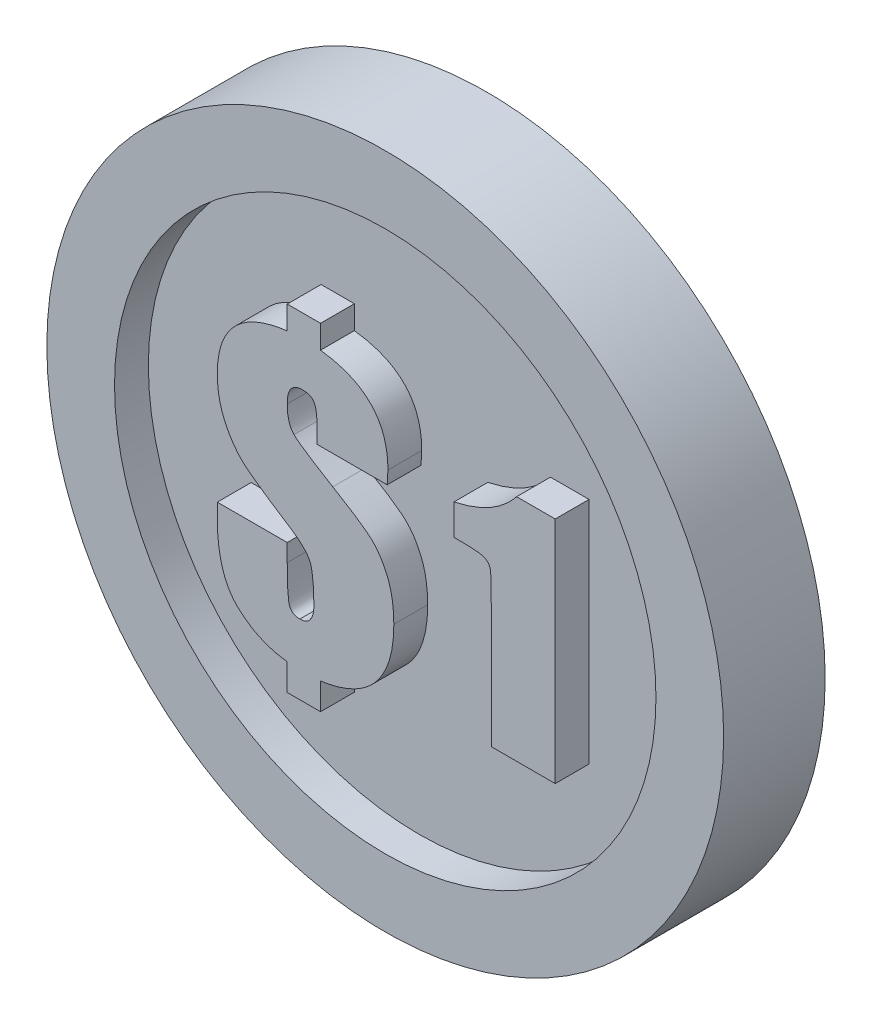
from build123d import *

# Parameters (mm, degrees)
SKETCH_1_R          = 10
EXTRUDE_1_DEPTH     = 3
SKETCH_2_R          = 8
CUT_EXTRUDE_1_DEPTH = 1
EXTRUDE_3_DEPTH     = 1


with BuildPart() as part:
    # 草图1 → 凸台-拉伸1 (new body)
    with BuildSketch(Plane.XY):
        Circle(SKETCH_1_R)
    extrude(amount=EXTRUDE_1_DEPTH)

    # 草图2 → 切除-拉伸1 (cut)
    with BuildSketch(Plane.XY.offset(3)):
        Circle(SKETCH_2_R)
    extrude(amount=-CUT_EXTRUDE_1_DEPTH, mode=Mode.SUBTRACT)

    # 草图4 → 凸台-拉伸3 (add)
    with BuildSketch(Plane.XY.offset(2)):
        with BuildLine():
            Line((0.056762987, 1.474211792), (-2.010233509, 1.474211792))
            Line((-2.010233509, 1.474211792), (-2.010233509, 1.80333177))
            add(Edge.make_bspline(
                [(-2.010233509, 1.80333177), (-2.010714949, 1.845366066), (-2.011636853, 1.925857174), (-2.013443384, 2.040830842), (-2.021934942, 2.144355468), (-2.031073109, 2.236120108), (-2.040588927, 2.31710552), (-2.056465146, 2.385691054), (-2.072751931, 2.443681195), (-2.098421022, 2.504945758), (-2.146218174, 2.567628601), (-2.227072107, 2.622444592), (-2.333658747, 2.649566324), (-2.411001767, 2.653311278), (-2.45316133, 2.655352647)],
                knots=[0, 0, 0, 0, 1.359919446, 2.604097865, 3.718258517, 4.718210111, 5.588312068, 6.352757529, 6.992875727, 7.535071206, 8.493600252, 9.496298216, 10.635235939, 12, 12, 12, 12], degree=3))
            add(Edge.make_bspline(
                [(-2.45316133, 2.655352647), (-2.48769324, 2.653727226), (-2.553890817, 2.650611298), (-2.646642148, 2.622991559), (-2.725077805, 2.574799662), (-2.789460033, 2.508992999), (-2.837678653, 2.423435949), (-2.872664288, 2.321405275), (-2.891615661, 2.200286181), (-2.894528446, 2.114059415), (-2.89608915, 2.067858107)],
                knots=[0, 0, 0, 0, 0.988105774, 1.894196063, 2.738146432, 3.600308196, 4.502221556, 5.528881054, 6.675945596, 8, 8, 8, 8], degree=3))
            add(Edge.make_bspline(
                [(-2.89608915, 2.067858107), (-2.894449613, 1.992202619), (-2.891412238, 1.85204466), (-2.851820774, 1.660792354), (-2.795166347, 1.499557252), (-2.727751468, 1.419469509), (-2.696156454, 1.381935163)],
                knots=[0, 0, 0, 0, 1.238590262, 2.294589406, 3.200733242, 4, 4, 4, 4], degree=3))
            add(Edge.make_bspline(
                [(-2.696156454, 1.381935163), (-2.676461776, 1.363134012), (-2.630861227, 1.319602312), (-2.545176258, 1.255053383), (-2.437113188, 1.178219265), (-2.306005051, 1.088728044), (-2.150665321, 0.987994219), (-1.972415244, 0.873613916), (-1.769467583, 0.749717147), (-1.625830171, 0.664089009), (-1.550388307, 0.619115027)],
                knots=[0, 0, 0, 0, 0.473750368, 1.096909409, 1.864751644, 2.783261057, 3.860202471, 5.088360878, 6.470736284, 8, 8, 8, 8], degree=3))
            add(Edge.make_bspline(
                [(-1.550388307, 0.619115027), (-1.485198527, 0.580292401), (-1.360104373, 0.505794778), (-1.181709189, 0.396565598), (-1.019465077, 0.294906955), (-0.873253022, 0.199660286), (-0.743042002, 0.110905609), (-0.629062244, 0.029561017), (-0.531324757, -0.044462306), (-0.421492641, -0.134926314), (-0.298119069, -0.256239512), (-0.16776821, -0.425307224), (-0.049470339, -0.620618928), (0.056905891, -0.841480009), (0.147481943, -1.089394), (0.208560212, -1.367548532), (0.2478522, -1.673343211), (0.251643957, -1.887086396), (0.253619796, -1.998465357)],
                knots=[0, 0, 0, 0, 1.071987144, 2.057060554, 2.955337459, 3.77699406, 4.522318602, 5.181589955, 5.755251306, 6.254177214, 7.191438167, 8.192596657, 9.262134101, 10.412151394, 11.651634359, 12.981704702, 14.427203216, 16, 16, 16, 16], degree=3))
            add(Edge.make_bspline(
                [(0.253619796, -1.998465357), (0.252520604, -2.088771103), (0.250373462, -2.265172779), (0.222764294, -2.521443005), (0.18288396, -2.763633873), (0.12157342, -2.989934303), (0.048224142, -3.203329396), (-0.04764749, -3.399426406), (-0.155935901, -3.582886354), (-0.284918565, -3.748769407), (-0.428419819, -3.901762054), (-0.591566185, -4.036202813), (-0.768685194, -4.159846558), (-0.965671944, -4.262796907), (-1.17743885, -4.354992249), (-1.406900356, -4.429013379), (-1.652957644, -4.490181019), (-1.823878665, -4.516421874), (-1.911805105, -4.529920886)],
                knots=[0, 0, 0, 0, 1.166783885, 2.279175364, 3.328322562, 4.336159768, 5.306592857, 6.240240115, 7.152837026, 8.055466775, 8.95076907, 9.858637968, 10.783210379, 11.737857823, 12.726337121, 13.765749244, 14.850640409, 16, 16, 16, 16], degree=3))
            Line((-1.911805105, -4.529920886), (-1.911805105, -5.317348123))
            Line((-1.911805105, -5.317348123), (-2.89608915, -5.317348123))
            Line((-2.89608915, -5.317348123), (-2.89608915, -4.529920886))
            add(Edge.make_bspline(
                [(-2.89608915, -4.529920886), (-2.964444513, -4.521229842), (-3.099464254, -4.504062754), (-3.297451441, -4.460222183), (-3.489345523, -4.402463406), (-3.673272398, -4.325457939), (-3.853248014, -4.239077881), (-4.024367639, -4.13315523), (-4.188527464, -4.012378649), (-4.349076156, -3.880100488), (-4.495366504, -3.723540065), (-4.622435632, -3.53984494), (-4.72817515, -3.328806901), (-4.813652178, -3.091543394), (-4.880733234, -2.828813828), (-4.929378662, -2.540298927), (-4.958678767, -2.225151111), (-4.961577762, -2.006221367), (-4.963085646, -1.892347233)],
                knots=[0, 0, 0, 0, 0.880722716, 1.739658008, 2.589843307, 3.439548281, 4.286822195, 5.140160776, 6.008178737, 6.892018721, 7.796500557, 8.738476021, 9.73819386, 10.806244783, 11.957388676, 13.201071447, 14.544165091, 16, 16, 16, 16], degree=3))
            Line((-4.963085646, -1.892347233), (-4.963085646, -1.478640345))
            Line((-4.963085646, -1.478640345), (-2.89608915, -1.478640345))
            Line((-2.89608915, -1.478640345), (-2.89608915, -1.992313581))
            add(Edge.make_bspline(
                [(-2.89608915, -1.992313581), (-2.895704026, -2.059471516), (-2.894971956, -2.187129782), (-2.891957149, -2.369133466), (-2.88733937, -2.53113795), (-2.881948967, -2.673237924), (-2.87257906, -2.794763684), (-2.861999559, -2.896309089), (-2.850782323, -2.978298671), (-2.831771987, -3.057698517), (-2.796329914, -3.13720338), (-2.724733914, -3.204634246), (-2.630260737, -3.245729545), (-2.560258212, -3.248728448), (-2.522368802, -3.250351627)],
                knots=[0, 0, 0, 0, 1.657418857, 3.150531957, 4.492147425, 5.657201955, 6.659563487, 7.499257938, 8.177392906, 8.69903519, 9.513866485, 10.283438363, 11.070897696, 12, 12, 12, 12], degree=3))
            add(Edge.make_bspline(
                [(-2.522368802, -3.250351627), (-2.489378542, -3.248660536), (-2.426843431, -3.245454967), (-2.339218716, -3.219229643), (-2.266135459, -3.173231759), (-2.207216552, -3.10880944), (-2.162940532, -3.026750233), (-2.13130144, -2.928258661), (-2.111154143, -2.813357435), (-2.109526388, -2.731132497), (-2.108661914, -2.687464189)],
                knots=[0, 0, 0, 0, 0.994883323, 1.88586392, 2.727487039, 3.570816153, 4.492326284, 5.520132617, 6.682983341, 8, 8, 8, 8], degree=3))
            add(Edge.make_bspline(
                [(-2.108661914, -2.687464189), (-2.108935574, -2.631069741), (-2.10946309, -2.52236181), (-2.114071505, -2.36544721), (-2.121638763, -2.220834196), (-2.132025717, -2.088463373), (-2.146270394, -1.969077806), (-2.160677831, -1.861524675), (-2.180587972, -1.767054101), (-2.204007286, -1.681855361), (-2.2351748, -1.60114895), (-2.282906179, -1.522964225), (-2.34325911, -1.442242229), (-2.419461819, -1.361342915), (-2.508937636, -1.278209236), (-2.613142538, -1.193590203), (-2.730821056, -1.105545843), (-2.817259718, -1.050516127), (-2.862254386, -1.02187103)],
                knots=[0, 0, 0, 0, 1.380366004, 2.660842346, 3.842046573, 4.924766116, 5.910024558, 6.784900421, 7.579810868, 8.270991265, 8.946735927, 9.689207242, 10.50484436, 11.410582145, 12.404987482, 13.492712756, 14.694859961, 16, 16, 16, 16], degree=3))
            add(Edge.make_bspline(
                [(-2.862254386, -1.02187103), (-2.937220205, -0.973865027), (-3.081396493, -0.881538587), (-3.286891769, -0.745807), (-3.474986034, -0.622159308), (-3.642992295, -0.505822423), (-3.79311186, -0.400793853), (-3.924056333, -0.305001794), (-4.036890963, -0.220601901), (-4.163849408, -0.119869901), (-4.304983023, 0.014315539), (-4.456319758, 0.199792286), (-4.595950479, 0.413669622), (-4.724454675, 0.652864388), (-4.833140109, 0.915678198), (-4.906897048, 1.199845959), (-4.95494887, 1.499747864), (-4.960333437, 1.705735293), (-4.963085646, 1.811021489)],
                knots=[0, 0, 0, 0, 1.144251925, 2.200656203, 3.165654651, 4.037535326, 4.827334008, 5.520628553, 6.122925727, 6.638522573, 7.603341009, 8.619197825, 9.708488222, 10.881837927, 12.105530735, 13.353920843, 14.647511608, 16, 16, 16, 16], degree=3))
            add(Edge.make_bspline(
                [(-4.963085646, 1.811021489), (-4.961832651, 1.886969132), (-4.959387355, 2.035185564), (-4.933923027, 2.250632635), (-4.894562266, 2.45413148), (-4.83767485, 2.644637628), (-4.765374936, 2.823312376), (-4.675972901, 2.98828905), (-4.570048913, 3.140778425), (-4.448675351, 3.280849467), (-4.310302398, 3.408108551), (-4.155692946, 3.521790754), (-3.985325259, 3.623865012), (-3.798953475, 3.712921544), (-3.595929506, 3.788193762), (-3.377284846, 3.850499543), (-3.14270702, 3.902314827), (-2.979857079, 3.92384636), (-2.89608915, 3.934921906)],
                knots=[0, 0, 0, 0, 1.100217239, 2.147140655, 3.139410829, 4.100827409, 5.023841391, 5.928095608, 6.81431441, 7.709642577, 8.608754423, 9.533023434, 10.486107416, 11.483039549, 12.522183369, 13.62029137, 14.775908296, 16, 16, 16, 16], degree=3))
            Line((-2.89608915, 3.934921906), (-2.89608915, 4.623920738))
            Line((-2.89608915, 4.623920738), (-1.911805105, 4.623920738))
            Line((-1.911805105, 4.623920738), (-1.911805105, 3.934921906))
            add(Edge.make_bspline(
                [(-1.911805105, 3.934921906), (-1.83113698, 3.923684787), (-1.674057582, 3.90180353), (-1.447521608, 3.852095654), (-1.236442357, 3.791447846), (-1.041243092, 3.71680636), (-0.860526928, 3.631897354), (-0.697329997, 3.531284043), (-0.5494265, 3.419578532), (-0.416662802, 3.296239572), (-0.298135254, 3.160524603), (-0.199220323, 3.009701153), (-0.111370998, 2.849607494), (-0.042910487, 2.675016965), (0.012954, 2.489539125), (0.050711945, 2.290569889), (0.074127815, 2.080216319), (0.07688497, 1.935659253), (0.0782942, 1.861773635)],
                knots=[0, 0, 0, 0, 1.217065147, 2.369905846, 3.463567771, 4.496793418, 5.490769135, 6.443602658, 7.357042595, 8.257109579, 9.148127797, 10.042894642, 10.948036131, 11.87297517, 12.840365016, 13.839761067, 14.895864502, 16, 16, 16, 16], degree=3))
            add(Edge.make_bspline(
                [(0.0782942, 1.861773635), (0.077810751, 1.837679646), (0.076740765, 1.784353921), (0.074244937, 1.695560092), (0.065389733, 1.590583694), (0.059765481, 1.514714431), (0.056762987, 1.474211792)],
                knots=[0, 0, 0, 0, 0.744858199, 1.648548241, 2.744682654, 4, 4, 4, 4], degree=3))
        make_face()
        with BuildLine():
            Line((5.023175077, 3.083267731), (5.023175077, -3.688606503))
            Line((5.023175077, -3.688606503), (3.133349709, -3.688606503))
            Line((3.133349709, -3.688606503), (3.133349709, -0.049216244))
            add(Edge.make_bspline(
                [(3.133349709, -0.049216244), (3.133593958, 0.010662586), (3.134055716, 0.123864492), (3.130999708, 0.284214806), (3.128343293, 0.425283899), (3.127055881, 0.546751118), (3.121323717, 0.64841284), (3.116976452, 0.730915963), (3.111457202, 0.794221383), (3.102291906, 0.852121983), (3.083359365, 0.90808358), (3.047418069, 0.964547564), (2.998087245, 1.01190667), (2.94587648, 1.044463224), (2.893097842, 1.065050405), (2.840089727, 1.077930703), (2.775346455, 1.090596163), (2.697463576, 1.098009477), (2.607659433, 1.105428465), (2.505139966, 1.112148942), (2.390217008, 1.113575298), (2.30942017, 1.114313637), (2.267179749, 1.11469964)],
                knots=[0, 0, 0, 0, 1.950419782, 3.687300443, 5.223822311, 6.546637084, 7.643380878, 8.540030222, 9.237904201, 9.712291202, 10.447402628, 11.144124893, 11.871548827, 12.657464658, 13.131287025, 13.711290926, 14.431812681, 15.278611421, 16.257109778, 17.367920147, 18.623954072, 20, 20, 20, 20], degree=3))
            Line((2.267179749, 1.11469964), (2.030951578, 1.11469964))
            Line((2.030951578, 1.11469964), (2.030951578, 2.023932027))
            add(Edge.make_bspline(
                [(2.030951578, 2.023932027), (2.130150393, 2.047183275), (2.324590782, 2.092758233), (2.604092231, 2.182654867), (2.864873324, 2.289383591), (3.106344693, 2.414498141), (3.329490435, 2.555636371), (3.533824466, 2.714185), (3.720026359, 2.888796928), (3.828520908, 3.018549566), (3.882635939, 3.083267731)],
                knots=[0, 0, 0, 0, 1.122506737, 2.20023443, 3.231784783, 4.224338166, 5.193566431, 6.137412817, 7.070976693, 8, 8, 8, 8], degree=3))
            Line((3.882635939, 3.083267731), (5.023175077, 3.083267731))
        make_face()
    extrude(amount=EXTRUDE_3_DEPTH)


solid = part.part
